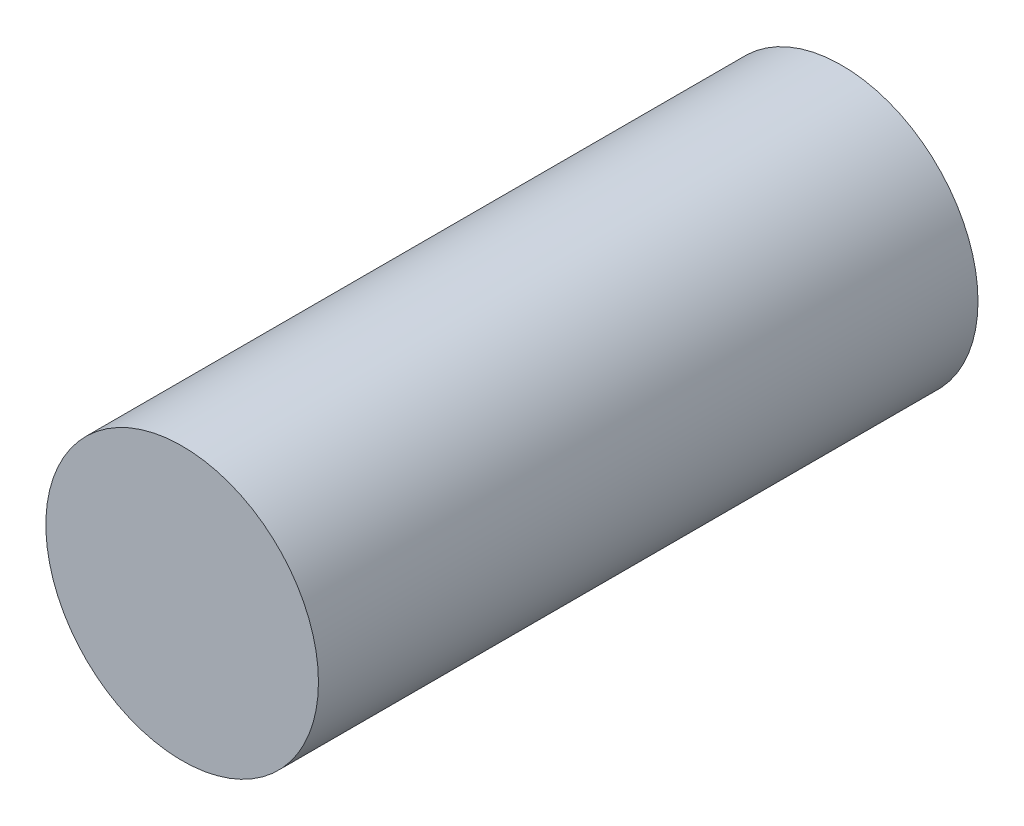
from build123d import *

# Parameters (mm, degrees)
SKETCH1_R           = 1.55
BOSS_EXTRUDE1_DEPTH = 7.5


with BuildPart() as part:
    # Sketch1 → Boss-Extrude1 (new body)
    with BuildSketch(Plane.XY):
        Circle(SKETCH1_R)
    extrude(amount=BOSS_EXTRUDE1_DEPTH)


solid = part.part
